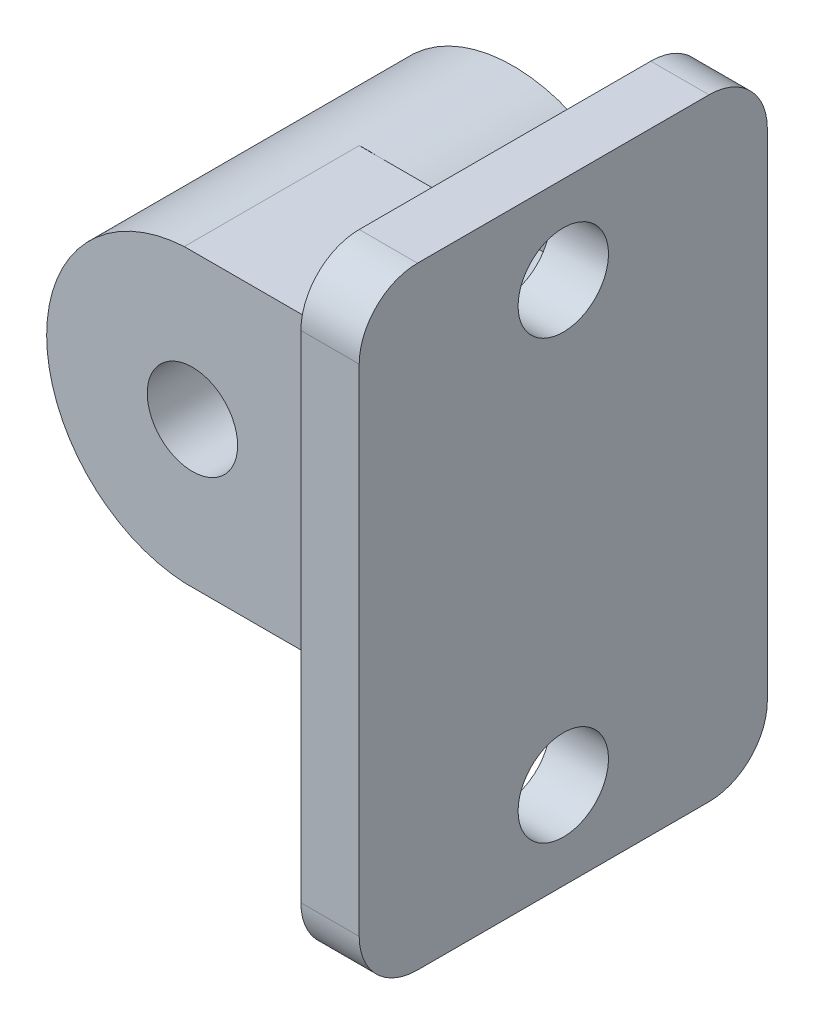
from build123d import *
from build123d.topology import SkipClean

# Parameters (mm, degrees)
BOSS_EXTRU_1_DEPTH      = 3
BOSS_EXTRU_1_DEPTH_BACK = 3
ESQUISSE1_R             = 1.55
SKETCH1_W               = 14
SKETCH1_H               = 21
BOSS_EXTRUDE1_DEPTH     = 2
SKETCH3_R               = 1.55
CUT_EXTRUDE1_DEPTH      = 2
FILLET1_R               = 2
BOSS_EXTRUDE3_START     = -5
SKETCH4_R               = 5
SKETCH4_R_2             = 1.55
BOSS_EXTRUDE3_DEPTH     = 5


with BuildPart() as part:
    # Esquisse1 → Boss.-Extru.1 (new, two sides: drawn at the far end of the back side and taken through both)
    with BuildSketch(Plane.XY.offset(-BOSS_EXTRU_1_DEPTH_BACK)):
        with BuildLine():
            Line((-0.279242011, 4.9921963), (7.720757989, 4.9921963))
            Line((7.720757989, 4.9921963), (7.720757989, -4.9921963))
            Line((7.720757989, -4.9921963), (-0.279242011, -4.9921963))
            ThreePointArc((-0.279242011, -4.9921963), (-5, 0), (-0.279242011, 4.9921963))
        make_face()
        Circle(ESQUISSE1_R, mode=Mode.SUBTRACT)
    extrude(amount=BOSS_EXTRU_1_DEPTH + BOSS_EXTRU_1_DEPTH_BACK)

    # Sketch1 → Boss-Extrude1 (add)
    with BuildSketch(Plane(origin=(7.720757989, 0, 0), x_dir=(0, 0, -1), z_dir=(1, 0, 0))):
        Rectangle(SKETCH1_W, SKETCH1_H)
    extrude(amount=BOSS_EXTRUDE1_DEPTH)

    # Sketch3 → Cut-Extrude1 (cut)
    with BuildSketch(Plane.ZY.offset(-7.720757989)):
        with Locations((0, 7.5)):
            Circle(SKETCH3_R)
        with Locations((0, -7.5)):
            Circle(SKETCH3_R)
    extrude(amount=-CUT_EXTRUDE1_DEPTH, mode=Mode.SUBTRACT)

    # Fillet1
    fillet1_edges = [part.edges().sort_by_distance(p)[0] for p in [
        (8.720757989, -10.5, -7),
        (8.720757989, 10.5, -7),
        (8.720757989, 10.5, 7),
        (8.720757989, -10.5, 7),
    ]]
    fillet(fillet1_edges, radius=FILLET1_R)

    # Sketch4 → Boss-Extrude3 (add)
    with SkipClean():  # the faces are left unmerged after this step: merging them gives an invalid solid
        with BuildSketch(Plane.XY.offset(-3).offset(BOSS_EXTRUDE3_START)):
            Circle(SKETCH4_R)
            Circle(SKETCH4_R_2, mode=Mode.SUBTRACT)
        extrude(amount=BOSS_EXTRUDE3_DEPTH)


solid = part.part
